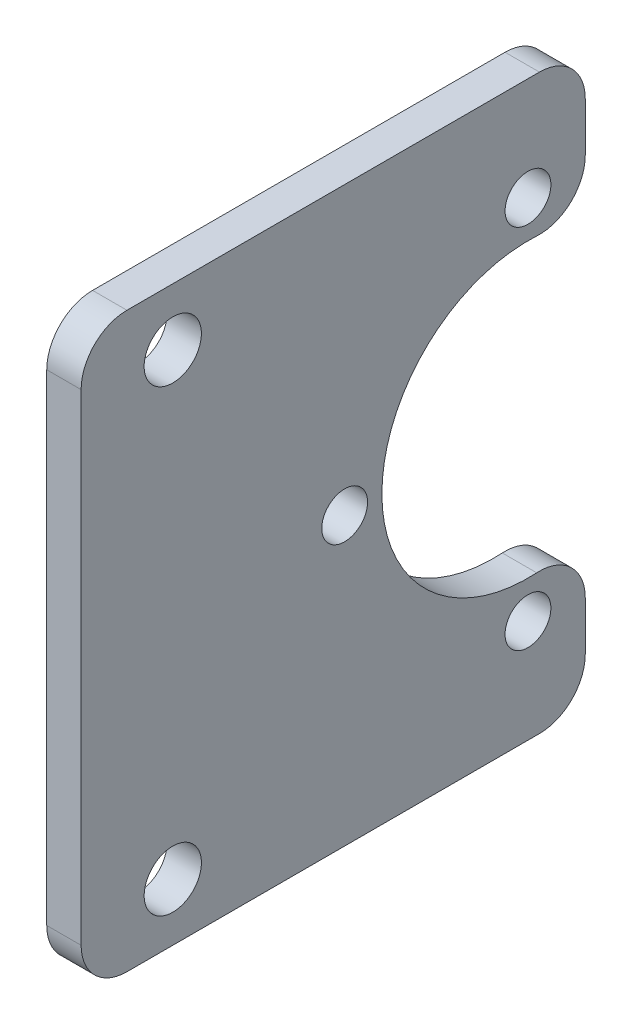
from build123d import *

# Parameters (mm, degrees)
ESQUISSE1_R        = 2
ESQUISSE1_R_2      = 2.5
BOSS_EXTRU_1_DEPTH = 3
CONG_1_R           = 4


with BuildPart() as part:
    # Esquisse1 → Boss.-Extru.1 (new body)
    with BuildSketch(Plane(origin=(0, 0, 0), x_dir=(0, 0, -1), z_dir=(1, 0, 0))):
        with BuildLine():
            Line((0, 25), (44, 25))
            Line((44, 25), (44, 11.728704106))
            ThreePointArc((44, 11.728704106), (26.25, 0), (44, -11.728704106))
            Line((44, -11.728704106), (44, -25))
            Line((44, -25), (0, -25))
            Line((0, -25), (0, 25))
        make_face()
        with Locations((39, 16)):
            Circle(ESQUISSE1_R, mode=Mode.SUBTRACT)
        with Locations((23, 0)):
            Circle(ESQUISSE1_R, mode=Mode.SUBTRACT)
        with Locations(Location((39, -16, 0), (0, 0, 180))):
            Circle(ESQUISSE1_R, mode=Mode.SUBTRACT)
        with Locations((8, 20)):
            Circle(ESQUISSE1_R_2, mode=Mode.SUBTRACT)
        with Locations(Location((8, -20, 0), (0, 0, 180))):
            Circle(ESQUISSE1_R_2, mode=Mode.SUBTRACT)
    extrude(amount=BOSS_EXTRU_1_DEPTH)

    # Congé1
    cong_1_edges = [part.edges().sort_by_distance(p)[0] for p in [
        (1.5, 25, 0),
        (1.5, 25, -44),
        (1.5, 11.728704106, -44),
        (1.5, -11.728704106, -44),
        (1.5, -25, -44),
        (1.5, -25, 0),
    ]]
    fillet(cong_1_edges, radius=CONG_1_R)


solid = part.part
